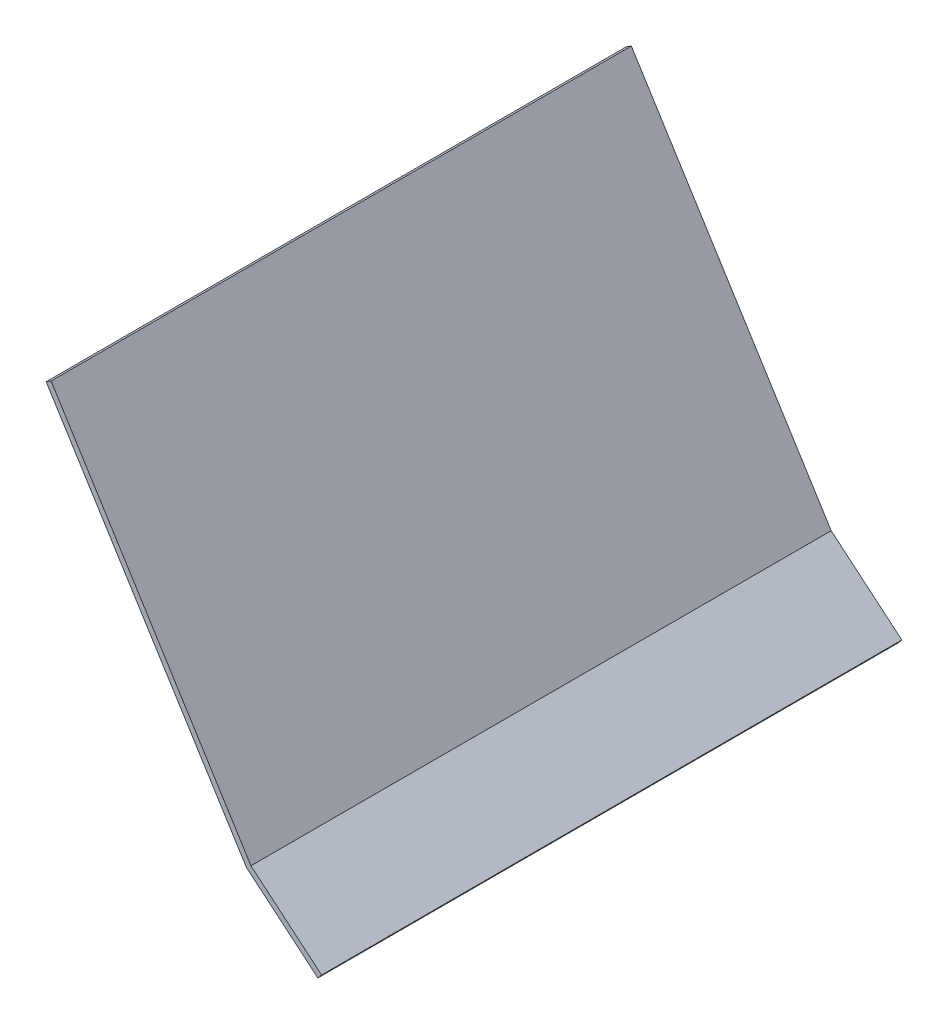
from build123d import *

# Parameters (mm, degrees)
RESSALTO_EXTRUS_O1_DEPTH = 100


with BuildPart() as part:
    # Esboço1 → Ressalto-extrusão1 (new body)
    with BuildSketch(Plane.XY):
        Polygon((-9.828405069, 4.570933406), (-22.126818959, 14.890527965), (-31.568264957, 30), (-56.655502101, 70.147971839), (-55.807454005, 70.677891103), (-30.720216861, 30.529919264), (-21.362701829, 15.554764853), (-9.18561746, 5.336977849), align=None)
    extrude(amount=-RESSALTO_EXTRUS_O1_DEPTH)


solid = part.part
